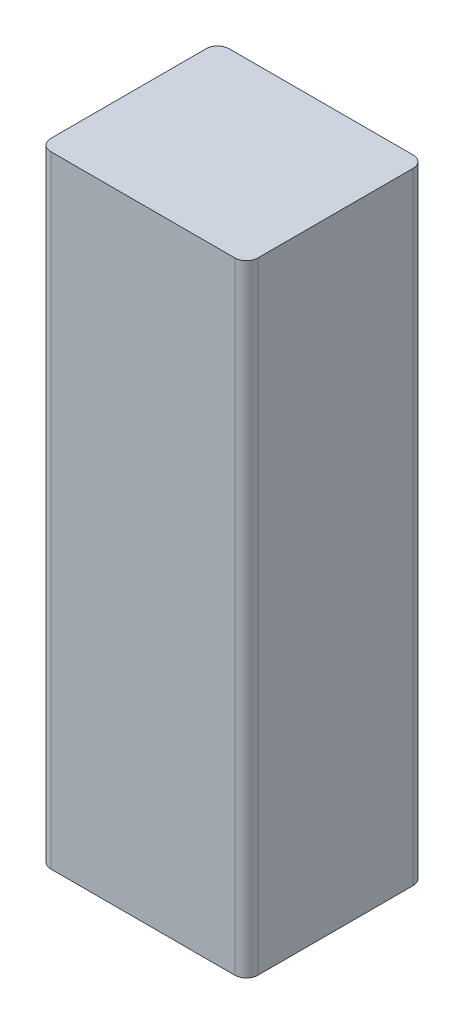
from build123d import *

# Parameters (mm, degrees)
BOSS_EXTRUDE1_DEPTH  = 310
SKETCH2_W            = 250
SKETCH2_H            = 250
CUT_EXTRUDE3_DEPTH   = 100
SKETCH4_W            = 250
SKETCH4_H            = 550
CUT_EXTRUDE4_DEPTH   = 300
FILLET1_R            = 20
FILLET3_R            = 5
SKETCH6_W            = 34
SKETCH6_H            = 34
SKETCH6_W_2          = 30
SKETCH6_H_2          = 30
BOSS_EXTRUDE4_DEPTH  = 2
SKETCH8_W            = 26
SKETCH8_H            = 26
BOSS_EXTRUDE5_DEPTH  = 2
SKETCH9_R            = 2.5
BOSS_EXTRUDE6_DEPTH  = 2
SKETCH10_R           = 2.5
BOSS_EXTRUDE7_DEPTH  = 3
SKETCH17_R           = 10
BOSS_EXTRUDE15_DEPTH = 150
SKETCH19_R           = 10
CUT_EXTRUDE5_DEPTH   = 120
SKETCH20_R           = 5
BOSS_EXTRUDE16_DEPTH = 30
SKETCH22_R           = 10
BOSS_EXTRUDE20_DEPTH = 200
SKETCH27_R           = 10
CUT_EXTRUDE7_DEPTH   = 170
SKETCH28_R           = 5
BOSS_EXTRUDE21_DEPTH = 30


with BuildPart() as part:
    # Sketch1 → Boss-Extrude1 (new body)
    with BuildSketch(Plane.XY):
        Polygon((-360, -166.674176782), (-360, -422.512102988), (0, -422.512102988), (0, 657.487897012), (-360, 657.487897012), align=None)
    extrude(amount=BOSS_EXTRUDE1_DEPTH)

    # Sketch2 → Cut-Extrude3 (cut)
    with BuildSketch(Plane.ZY.offset(360)):
        with Locations((155, 432.487897012)):
            Rectangle(SKETCH2_W, SKETCH2_H)
    extrude(amount=-CUT_EXTRUDE3_DEPTH, mode=Mode.SUBTRACT)

    # Sketch4 → Cut-Extrude4 (cut)
    with BuildSketch(Plane.ZY.offset(360)):
        with Locations((155, -79.051121205)):
            Rectangle(SKETCH4_W, SKETCH4_H)
    extrude(amount=-CUT_EXTRUDE4_DEPTH, mode=Mode.SUBTRACT)

    # Fillet1
    fillet1_edges = [part.edges().sort_by_distance(p)[0] for p in [
        (-360, 117.487897012, 0),
        (0, 117.487897012, 0),
        (0, 117.487897012, 310),
        (-360, 117.487897012, 310),
    ]]
    fillet(fillet1_edges, radius=FILLET1_R)

    # Fillet3
    fillet3_edges = [part.edges().sort_by_distance(p)[0] for p in [
        (-60, -79.051121205, 30),
        (-60, -79.051121205, 280),
        (-360, 432.487897012, 280),
        (-260, 432.487897012, 280),
        (-360, 432.487897012, 30),
        (-260, 432.487897012, 30),
    ]]
    fillet(fillet3_edges, radius=FILLET3_R)

    # Sketch6 → Boss-Extrude4 (add)
    # profile 1 of 3: a face of its own
    with BuildSketch(Plane.ZY.offset(360)):
        with Locations((94.240330872, 593.82204287)):
            Rectangle(SKETCH6_W, SKETCH6_H)
        with Locations((94.240330872, 593.82204287)):
            Rectangle(SKETCH6_W_2, SKETCH6_H_2, mode=Mode.SUBTRACT)
    # profile 2 of 3: a face of its own
    with BuildSketch(Plane.ZY.offset(360)):
        with Locations((154.240330872, 593.82204287)):
            Rectangle(SKETCH6_W, SKETCH6_H)
        with Locations((154.240330872, 593.82204287)):
            Rectangle(SKETCH6_W_2, SKETCH6_H_2, mode=Mode.SUBTRACT)
    # profile 3 of 3: a face of its own
    with BuildSketch(Plane.ZY.offset(360)):
        with Locations((214.240330872, 593.82204287)):
            Rectangle(SKETCH6_W, SKETCH6_H)
        with Locations((214.240330872, 593.82204287)):
            Rectangle(SKETCH6_W_2, SKETCH6_H_2, mode=Mode.SUBTRACT)
    extrude(amount=BOSS_EXTRUDE4_DEPTH)

    # Sketch8 → Boss-Extrude5 (add)
    with BuildSketch(Plane.ZY.offset(360)):
        with Locations((94.240330872, 593.82204287)):
            Rectangle(SKETCH8_W, SKETCH8_H)
        with Locations((154.240330872, 593.82204287)):
            Rectangle(SKETCH8_W, SKETCH8_H)
        with Locations((214.240330872, 593.82204287)):
            Rectangle(SKETCH8_W, SKETCH8_H)
    extrude(amount=BOSS_EXTRUDE5_DEPTH)

    # Sketch9 → Boss-Extrude6 (add)
    with BuildSketch(Plane.ZY.offset(360)):
        with BuildLine():
            Line((42.525828736, 578.446941707), (42.525828736, 608.446941707))
            ThreePointArc((42.525828736, 608.446941707), (48.500463489, 614.42157646), (54.475098242, 608.446941707))
            Line((54.475098242, 608.446941707), (54.475098242, 578.446941707))
            ThreePointArc((54.475098242, 578.446941707), (48.500463489, 572.472306954), (42.525828736, 578.446941707))
        make_face()
        with Locations((48.500463489, 604.166154606)):
            Circle(SKETCH9_R, mode=Mode.SUBTRACT)
        with Locations((48.500463489, 583.02259952)):
            Circle(SKETCH9_R, mode=Mode.SUBTRACT)
    extrude(amount=BOSS_EXTRUDE6_DEPTH)

    # Sketch10 → Boss-Extrude7 (add)
    with BuildSketch(Plane.ZY.offset(360)):
        with Locations((48.500463489, 604.166154606)):
            Circle(SKETCH10_R)
        with Locations((48.500463489, 583.02259952)):
            Circle(SKETCH10_R)
    extrude(amount=BOSS_EXTRUDE7_DEPTH)

    # Sketch17 → Boss-Extrude15 (add)
    with BuildSketch(Plane(origin=(0, -354.051121205, 0), x_dir=(1, 0, 0), z_dir=(0, 1, 0))):
        with Locations((-349.825795865, -39.522123793)):
            Circle(SKETCH17_R)
    extrude(amount=BOSS_EXTRUDE15_DEPTH)

    # Sketch19 → Cut-Extrude5 (cut)
    with BuildSketch(Plane(origin=(0, -354.051121205, 0), x_dir=(1, 0, 0), z_dir=(0, 1, 0))):
        with Locations((-349.825795865, -39.522123793)):
            Circle(SKETCH19_R)
    extrude(amount=CUT_EXTRUDE5_DEPTH, mode=Mode.SUBTRACT)

    # Sketch20 → Boss-Extrude16 (add)
    with BuildSketch(Plane(origin=(0, -204.051121205, 0), x_dir=(1, 0, 0), z_dir=(0, 1, 0))):
        with Locations((-349.825795865, -39.522123793)):
            Circle(SKETCH20_R)
    extrude(amount=BOSS_EXTRUDE16_DEPTH)

    # Sketch22 → Boss-Extrude20 (add)
    with BuildSketch(Plane(origin=(0, -174.051121205, 0), x_dir=(1, 0, 0), z_dir=(0, 1, 0))):
        with Locations((-349.825795865, -39.522123793)):
            Circle(SKETCH22_R)
    extrude(amount=BOSS_EXTRUDE20_DEPTH)

    # Sketch27 → Cut-Extrude7 (cut)
    with BuildSketch(Plane.XZ.offset(174.051121205)):
        with Locations((-349.825795865, 39.522123793)):
            Circle(SKETCH27_R)
    extrude(amount=-CUT_EXTRUDE7_DEPTH, mode=Mode.SUBTRACT)

    # Sketch28 → Boss-Extrude21 (add)
    with BuildSketch(Plane(origin=(0, 25.948878795, 0), x_dir=(1, 0, 0), z_dir=(0, 1, 0))):
        with Locations((-349.825795865, -39.522123793)):
            Circle(SKETCH28_R)
    extrude(amount=BOSS_EXTRUDE21_DEPTH)


solid = part.part
